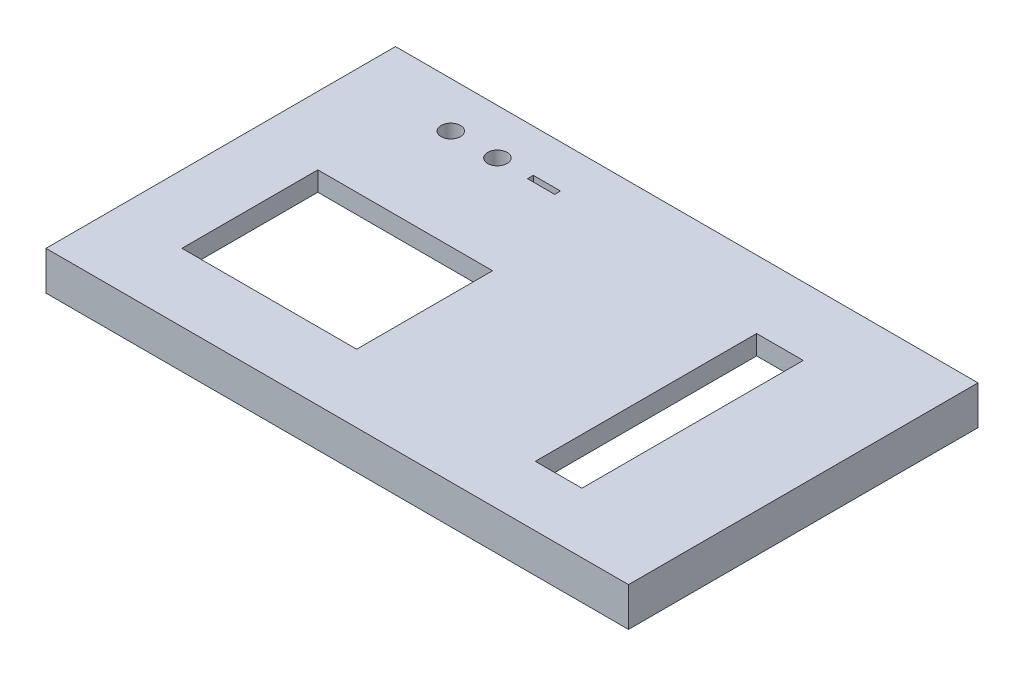
from build123d import *

# Parameters (mm, degrees)
SKETCH6_W           = 150
SKETCH6_H           = 90
BOSS_EXTRUDE1_DEPTH = 10
SKETCH7_W           = 145
SKETCH7_H           = 85
CUT_EXTRUDE1_DEPTH  = 10
SKETCH2_W           = 45
SKETCH2_H           = 35
CUT_EXTRUDE2_DEPTH  = 10
SKETCH4_R           = 2.5
CUT_EXTRUDE3_DEPTH  = 10
SKETCH5_W           = 7
SKETCH5_H           = 1.5
CUT_EXTRUDE4_DEPTH  = 10
SKETCH3_W           = 12
SKETCH3_H           = 57
CUT_EXTRUDE5_DEPTH  = 10


with BuildPart() as part:
    # Sketch6 → Boss-Extrude1 (new body)
    with BuildSketch(Plane(origin=(0, 0, 0), x_dir=(1, 0, 0), z_dir=(0, 1, 0))):
        with Locations((-292.180819859, -3.647511649)):
            Rectangle(SKETCH6_W, SKETCH6_H)
    extrude(amount=-BOSS_EXTRUDE1_DEPTH)

    # Sketch7 → Cut-Extrude1 (cut)
    with BuildSketch(Plane(origin=(0, -5, 0), x_dir=(1, 0, 0), z_dir=(0, 1, 0))):
        with Locations((-292.180819859, -3.647511649)):
            Rectangle(SKETCH7_W, SKETCH7_H)
    extrude(amount=-CUT_EXTRUDE1_DEPTH, mode=Mode.SUBTRACT)

    # Sketch2 → Cut-Extrude2 (cut)
    with BuildSketch(Plane(origin=(0, 0, 0), x_dir=(1, 0, 0), z_dir=(0, 1, 0))):
        with Locations((-327.180819859, -13.647511649)):
            Rectangle(SKETCH2_W, SKETCH2_H)
    extrude(amount=-CUT_EXTRUDE2_DEPTH, mode=Mode.SUBTRACT)

    # Sketch4 → Cut-Extrude3 (cut)
    with BuildSketch(Plane(origin=(0, 0, 0), x_dir=(1, 0, 0), z_dir=(0, 1, 0))):
        with Locations(Location((-341.213762503, 29.627320544, 0), (0, 0, 270))):
            Circle(SKETCH4_R)
        with Locations(Location((-329.213762503, 29.627320544, 0), (0, 0, 270))):
            Circle(SKETCH4_R)
    extrude(amount=-CUT_EXTRUDE3_DEPTH, mode=Mode.SUBTRACT)

    # Sketch5 → Cut-Extrude4 (cut)
    with BuildSketch(Plane(origin=(0, 0, 0), x_dir=(1, 0, 0), z_dir=(0, 1, 0))):
        with Locations((-317.213762503, 29.627320544)):
            Rectangle(SKETCH5_W, SKETCH5_H)
    extrude(amount=-CUT_EXTRUDE4_DEPTH, mode=Mode.SUBTRACT)

    # Sketch3 → Cut-Extrude5 (cut)
    with BuildSketch(Plane(origin=(0, 0, 0), x_dir=(1, 0, 0), z_dir=(0, 1, 0))):
        with Locations((-250.680819859, -4.647511649)):
            Rectangle(SKETCH3_W, SKETCH3_H)
    extrude(amount=-CUT_EXTRUDE5_DEPTH, mode=Mode.SUBTRACT)


solid = part.part
